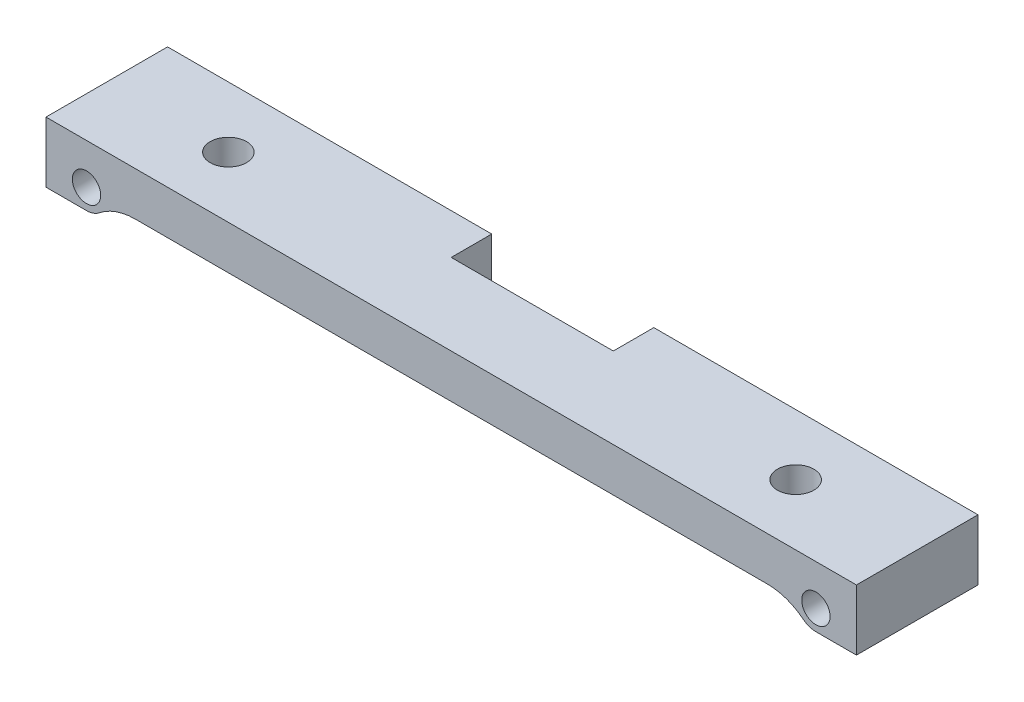
from build123d import *

# Parameters (mm, degrees)
SKETCH1_R           = 1.75
BOSS_EXTRUDE1_DEPTH = 15
SKETCH2_R           = 2.25
SKETCH2_W           = 20
SKETCH2_H           = 5
CUT_EXTRUDE1_DEPTH  = 15


with BuildPart() as part:
    # Sketch1 → Boss-Extrude1 (new body)
    with BuildSketch(Plane.XY):
        with BuildLine():
            Line((50, 57.5), (50, 65))
            Line((50, 65), (-50, 65))
            Line((-50, 65), (-50, 57.5))
            Line((-50, 57.5), (-45, 57.5))
            ThreePointArc((-45, 57.5), (-44.172482646, 57.640929202), (-43.438262381, 58.047827976))
            ThreePointArc((-43.438262381, 58.047827976), (-41.351700501, 59.204183244), (-39, 59.604686356))
            Line((-39, 59.604686356), (39, 59.604686356))
            ThreePointArc((39, 59.604686356), (41.351700501, 59.204183244), (43.438262381, 58.047827976))
            ThreePointArc((43.438262381, 58.047827976), (44.172482646, 57.640929202), (45, 57.5))
            Line((45, 57.5), (50, 57.5))
        make_face()
        with Locations((45, 60)):
            Circle(SKETCH1_R, mode=Mode.SUBTRACT)
        with Locations(Location((-45, 60, 0), (0, 0, 180))):
            Circle(SKETCH1_R, mode=Mode.SUBTRACT)
    extrude(amount=BOSS_EXTRUDE1_DEPTH)

    # Sketch2 → Cut-Extrude1 (cut)
    with BuildSketch(Plane(origin=(0, 65, 0), x_dir=(1, 0, 0), z_dir=(0, 1, 0))):
        with Locations(Location((35, -7.5, 0), (0, 0, 270))):
            Circle(SKETCH2_R)
        with Locations(Location((-35, -7.5, 0), (0, 0, 270))):
            Circle(SKETCH2_R)
        with Locations((0, -2.5)):
            Rectangle(SKETCH2_W, SKETCH2_H)
    extrude(amount=-CUT_EXTRUDE1_DEPTH, mode=Mode.SUBTRACT)


solid = part.part
